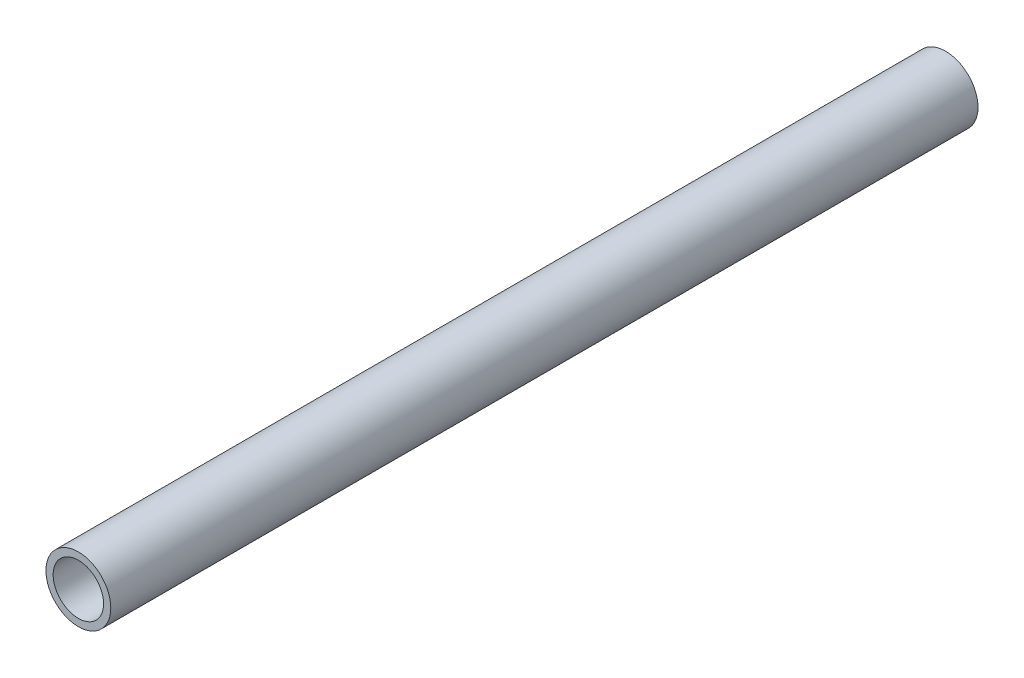
from build123d import *

# Parameters (mm, degrees)
SKETCH1_R           = 9
SKETCH1_R_2         = 7
BOSS_EXTRUDE1_DEPTH = 240.71


with BuildPart() as part:
    # Sketch1 → Boss-Extrude1 (new body)
    with BuildSketch(Plane.XY):
        Circle(SKETCH1_R)
        Circle(SKETCH1_R_2, mode=Mode.SUBTRACT)
    extrude(amount=BOSS_EXTRUDE1_DEPTH)


solid = part.part
